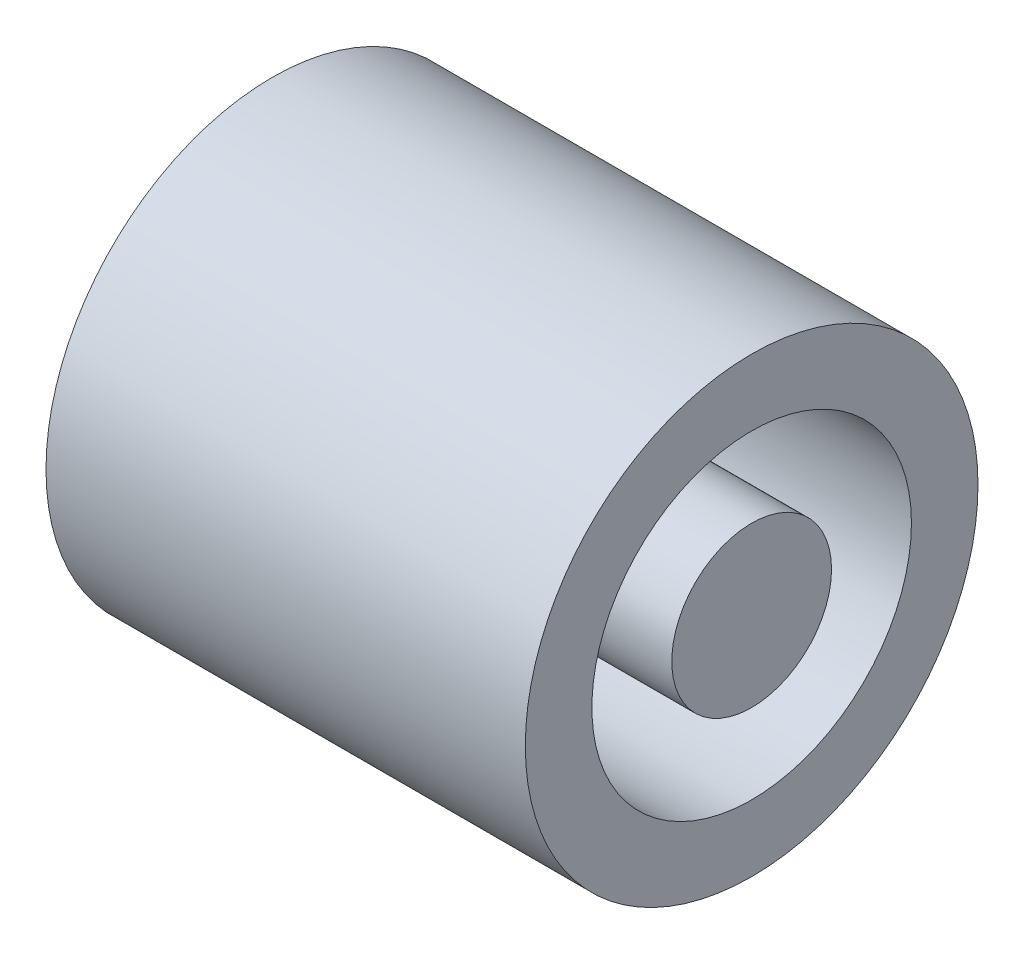
from build123d import *

# Parameters (mm, degrees)
SKETCH1_R           = 8.5
SKETCH1_R_2         = 6
BOSS_EXTRUDE1_DEPTH = 18
SKETCH2_R           = 3
BOSS_EXTRUDE2_DEPTH = 18


with BuildPart() as part:
    # Sketch1 → Boss-Extrude1 (new body)
    with BuildSketch(Plane(origin=(0, 0, 0), x_dir=(0, 0, -1), z_dir=(1, 0, 0))):
        Circle(SKETCH1_R)
        Circle(SKETCH1_R_2, mode=Mode.SUBTRACT)
    extrude(amount=BOSS_EXTRUDE1_DEPTH)


with BuildPart() as body_2:
    # Sketch2 → Boss-Extrude2 (new body)
    with BuildSketch(Plane(origin=(18, 0, 0), x_dir=(0, 0, -1), z_dir=(1, 0, 0))):
        Circle(SKETCH2_R)
    extrude(amount=-BOSS_EXTRUDE2_DEPTH)


solid = Compound([part.part, body_2.part])
